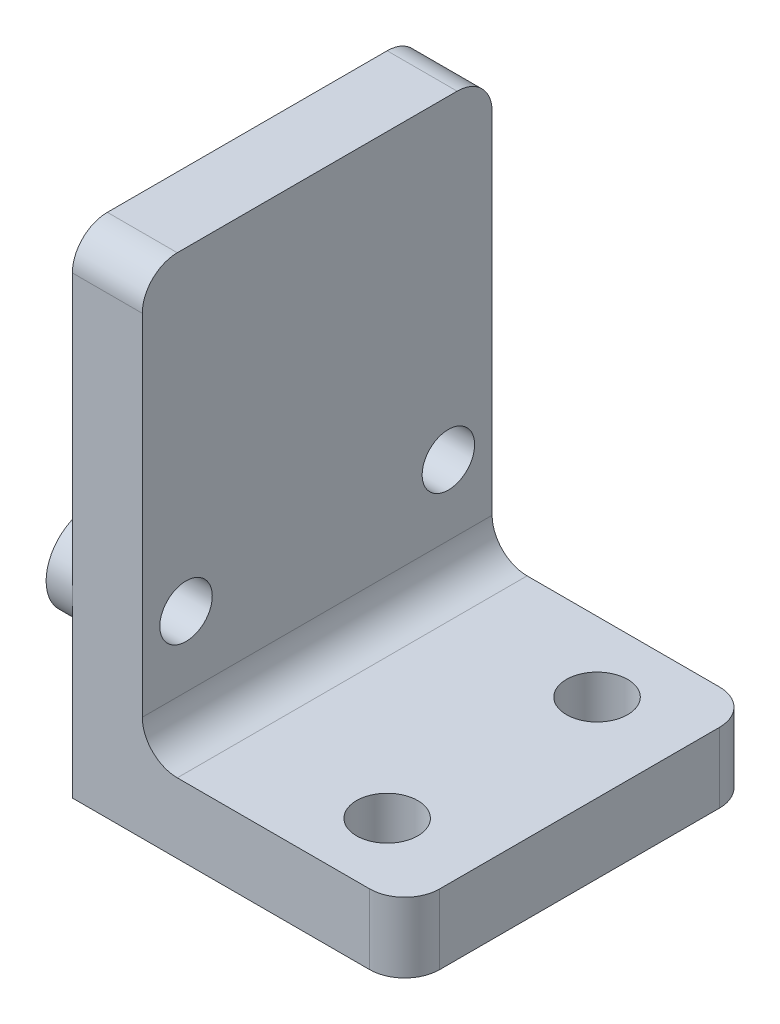
from build123d import *

# Parameters (mm, degrees)
BOSS_EXTRUDE1_DEPTH = 20
SKETCH2_R           = 1.5
CUT_EXTRUDE1_DEPTH  = 40.306488014
SKETCH3_R           = 1.75
CUT_EXTRUDE2_DEPTH  = 37.565010598
FILLET1_R           = 2
BOSS_EXTRUDE2_START = 1.5
SKETCH4_R           = 2.5
SKETCH4_R_2         = 1.5
BOSS_EXTRUDE2_DEPTH = 1.5


with BuildPart() as part:
    # Sketch1 → Boss-Extrude1 (new body)
    with BuildSketch(Plane.XY):
        Polygon((0, 0), (0, 28), (4, 28), (4, 4), (19, 4), (19, 0), align=None)
    extrude(amount=BOSS_EXTRUDE1_DEPTH)

    # Sketch2 → Cut-Extrude1 (cut, through all)
    with BuildSketch(Plane.ZY):
        with Locations(Location((17.5, 10, 0), (0, 0, 270))):
            Circle(SKETCH2_R)
        with Locations(Location((2.5, 10, 0), (0, 0, 270))):
            Circle(SKETCH2_R)
    extrude(amount=-CUT_EXTRUDE1_DEPTH, mode=Mode.SUBTRACT)

    # Sketch3 → Cut-Extrude2 (cut, through all)
    with BuildSketch(Plane(origin=(0, 4, 0), x_dir=(1, 0, 0), z_dir=(0, 1, 0))):
        with Locations(Location((14, -4, 0), (0, 0, 180))):
            Circle(SKETCH3_R)
        with Locations(Location((14, -16, 0), (0, 0, 180))):
            Circle(SKETCH3_R)
    extrude(amount=-CUT_EXTRUDE2_DEPTH, mode=Mode.SUBTRACT)

    # Fillet1
    fillet1_edges = [part.edges().sort_by_distance(p)[0] for p in [
        (4, 4, 10),
        (2, 28, 20),
        (2, 28, 0),
        (19, 2, 0),
        (19, 2, 20),
    ]]
    fillet(fillet1_edges, radius=FILLET1_R)

    # Sketch4 → Boss-Extrude2 (add)
    # profile 1 of 2: a face of its own
    with BuildSketch(Plane.ZY.offset(BOSS_EXTRUDE2_START)):
        with Locations(Location((2.5, 10, 0), (0, 0, 180))):
            Circle(SKETCH4_R)
        with Locations(Location((2.5, 10, 0), (0, 0, 270))):
            Circle(SKETCH4_R_2, mode=Mode.SUBTRACT)
    # profile 2 of 2: a face of its own
    with BuildSketch(Plane.ZY.offset(BOSS_EXTRUDE2_START)):
        with Locations((17.5, 10)):
            Circle(SKETCH4_R)
        with Locations(Location((17.5, 10, 0), (0, 0, 270))):
            Circle(SKETCH4_R_2, mode=Mode.SUBTRACT)
    extrude(amount=-BOSS_EXTRUDE2_DEPTH)


solid = part.part
